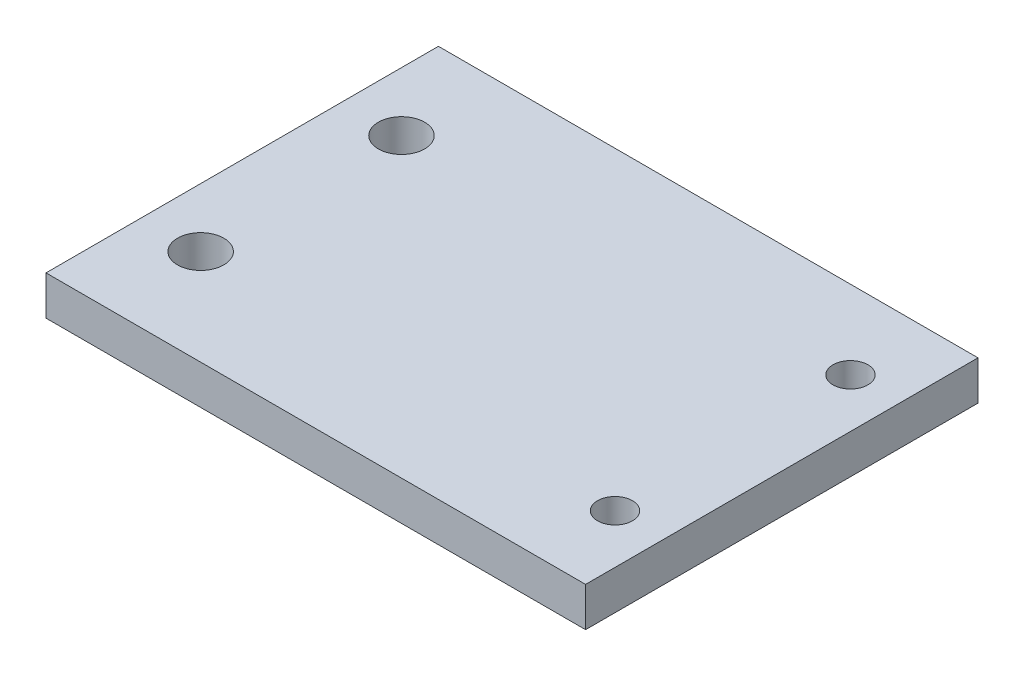
from build123d import *

# Parameters (mm, degrees)
SKETCH1_W               = 34.925
SKETCH1_H               = 25.4
BOSS_EXTRUDE1_DEPTH     = 2.54
CUT_EXTRUDE3_DEPTH      = 44.259302179
CUT_EXTRUDE3_DEPTH_BACK = 44.259302179
SKETCH2_R               = 1.5
SKETCH5_R               = 1.1303
CUT_EXTRUDE4_DEPTH      = 44.259302179


with BuildPart() as part:
    # Sketch1 → Boss-Extrude1 (new body)
    with BuildSketch(Plane(origin=(0, 0, 0), x_dir=(1, 0, 0), z_dir=(0, 1, 0))):
        with Locations((17.4625, 12.7)):
            Rectangle(SKETCH1_W, SKETCH1_H)
    extrude(amount=BOSS_EXTRUDE1_DEPTH)

    # Sketch2 → Cut-Extrude3 (cut, two sides: drawn at the far end of the back side and taken through both)
    with BuildSketch(Plane(origin=(0, 2.54, 0), x_dir=(1, 0, 0), z_dir=(0, 1, 0)).offset(-CUT_EXTRUDE3_DEPTH_BACK)):
        with Locations(Location((3.81, 19.2, 0), (0, 0, 90))):
            Circle(SKETCH2_R)
        with Locations(Location((3.81, 6.2, 0), (0, 0, 90))):
            Circle(SKETCH2_R)
    extrude(amount=CUT_EXTRUDE3_DEPTH + CUT_EXTRUDE3_DEPTH_BACK, mode=Mode.SUBTRACT)

    # Sketch5 → Cut-Extrude4 (cut, through all)
    with BuildSketch(Plane(origin=(0, 2.54, 0), x_dir=(1, 0, 0), z_dir=(0, 1, 0))):
        with Locations(Location((31.75, 20.32, 0), (0, 0, 270))):
            Circle(SKETCH5_R)
        with Locations(Location((31.75, 5.08, 0), (0, 0, 90))):
            Circle(SKETCH5_R)
    extrude(amount=-CUT_EXTRUDE4_DEPTH, mode=Mode.SUBTRACT)


solid = part.part
